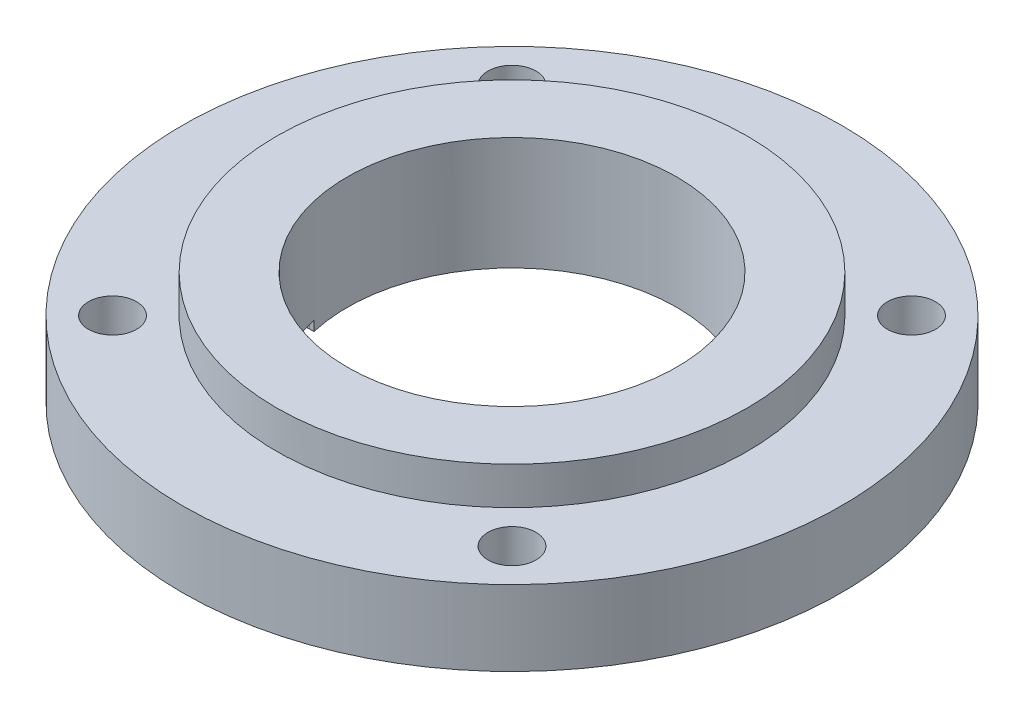
from build123d import *

# Parameters (mm, degrees)
SKETCH1_R           = 25
SKETCH1_R_2         = 17.5
BOSS_EXTRUDE2_DEPTH = 12
SKETCH4_R           = 35
SKETCH4_R_2         = 25
SKETCH4_R_3         = 2.55
BOSS_EXTRUDE3_DEPTH = 8
SKETCH2_R           = 14.5
SKETCH2_W           = 15.6
SKETCH2_H           = 14.1004027
SKETCH2_R_2         = 2
CUT_EXTRUDE2_DEPTH  = 1.05


with BuildPart() as part:
    # Sketch1 → Boss-Extrude2 (new body)
    with BuildSketch(Plane(origin=(0, 0, 0), x_dir=(1, 0, 0), z_dir=(0, 1, 0))):
        with Locations(Location((0, 0, 0), (0, 0, 270))):
            Circle(SKETCH1_R)
        with Locations(Location((0, 0, 0), (0, 0, 270))):
            Circle(SKETCH1_R_2, mode=Mode.SUBTRACT)
    extrude(amount=BOSS_EXTRUDE2_DEPTH)

    # Sketch4 → Boss-Extrude3 (add)
    with BuildSketch(Plane.XZ):
        with Locations(Location((0, 0, 0), (0, 0, 270))):
            Circle(SKETCH4_R)
        with Locations(Location((0, 0, 0), (0, 0, 270))):
            Circle(SKETCH4_R_2, mode=Mode.SUBTRACT)
        with Locations(Location((-21.213203436, 21.213203436, 0), (0, 0, 270))):
            Circle(SKETCH4_R_3, mode=Mode.SUBTRACT)
        with Locations(Location((21.213203436, 21.213203436, 0), (0, 0, 270))):
            Circle(SKETCH4_R_3, mode=Mode.SUBTRACT)
        with Locations(Location((21.213203436, -21.213203436, 0), (0, 0, 270))):
            Circle(SKETCH4_R_3, mode=Mode.SUBTRACT)
        with Locations(Location((-21.213203436, -21.213203436, 0), (0, 0, 270))):
            Circle(SKETCH4_R_3, mode=Mode.SUBTRACT)
    extrude(amount=-BOSS_EXTRUDE3_DEPTH)

    # Sketch2 → Cut-Extrude2 (cut)
    # profile 1 of 3: a face of its own
    with BuildSketch(Plane(origin=(0, 0, 0), x_dir=(1, 0, 0), z_dir=(0, 1, 0))):
        with Locations((0, -8)):
            Circle(SKETCH2_R)
    # profile 2 of 3: a face of its own
    with BuildSketch(Plane(origin=(0, 0, 0), x_dir=(1, 0, 0), z_dir=(0, 1, 0))):
        with Locations((0, -18.48979865)):
            Rectangle(SKETCH2_W, SKETCH2_H)
    # profile 3 of 3: a face of its own
    with BuildSketch(Plane(origin=(0, 0, 0), x_dir=(1, 0, 0), z_dir=(0, 1, 0))):
        with BuildLine():
            Line((-17.5, -4), (17.5, -4))
            ThreePointArc((17.5, -4), (21.5, -8), (17.5, -12))
            Line((17.5, -12), (-17.5, -12))
            ThreePointArc((-17.5, -12), (-21.5, -8), (-17.5, -4))
        make_face()
        with Locations((17.5, -8)):
            Circle(SKETCH2_R_2, mode=Mode.SUBTRACT)
        with Locations((-17.5, -8)):
            Circle(SKETCH2_R_2, mode=Mode.SUBTRACT)
    extrude(amount=CUT_EXTRUDE2_DEPTH, mode=Mode.SUBTRACT)


solid = part.part
